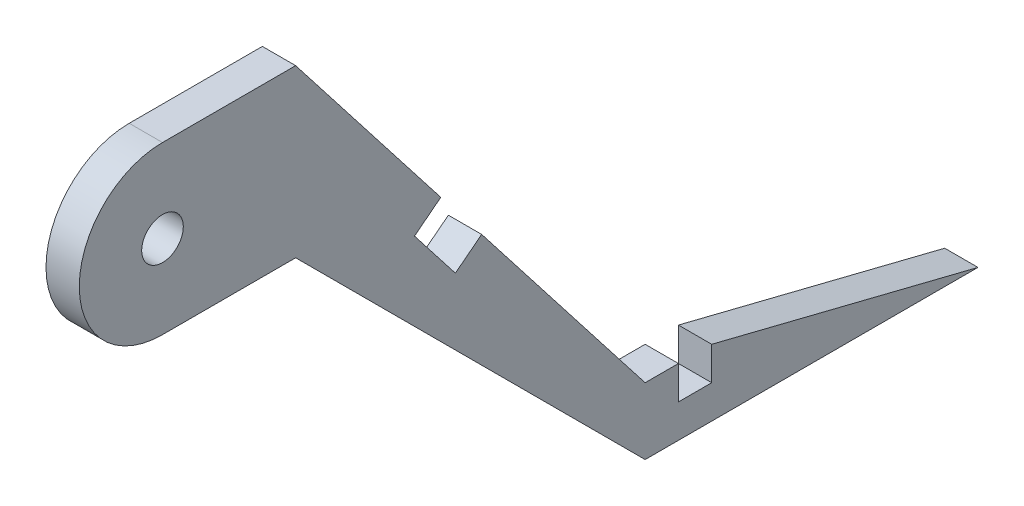
from build123d import *

# Parameters (mm, degrees)
MAIN_DEPTH    = 12.7
SKETCH2_R     = 7.9375
AXLE_DEPTH    = 12.7
SKETCH5_W     = 12.7
SKETCH5_H     = 25.4
BARWIDE_DEPTH = 12.7


with BuildPart() as part:
    # Sketch1 → main (new body)
    with BuildSketch(Plane(origin=(0, 0, 0), x_dir=(0, 0, -1), z_dir=(1, 0, 0))):
        with BuildLine():
            Line((0, 31.75), (50.8, 31.75))
            Line((50.8, 31.75), (184.15, -139.7))
            Line((184.15, -139.7), (196.85, -139.7))
            Line((196.85, -139.7), (196.85, -152.4))
            Line((196.85, -152.4), (209.55, -152.4))
            Line((209.55, -152.4), (209.55, -139.7))
            Line((209.55, -139.7), (311.15, -165.1))
            Line((311.15, -165.1), (184.15, -165.1))
            Line((184.15, -165.1), (50.8, -31.75))
            Line((50.8, -31.75), (0, -31.75))
            ThreePointArc((0, -31.75), (-31.75, 0), (0, 31.75))
        make_face()
    extrude(amount=MAIN_DEPTH)

    # Sketch2 → axle (cut)
    with BuildSketch(Plane(origin=(12.7, 0, 0), x_dir=(0, 0, -1), z_dir=(1, 0, 0))):
        Circle(SKETCH2_R)
    extrude(amount=-AXLE_DEPTH, mode=Mode.SUBTRACT)

    # Sketch5 → barwide (cut)
    with BuildSketch(Plane(origin=(0, 36.585769231, -47.038846154), x_dir=(-1, 0, 0), z_dir=(0, 0.6139406135149222, -0.789352217376325))):
        with Locations((-6.35, -109.029668746)):
            Rectangle(SKETCH5_W, SKETCH5_H)
    extrude(amount=-BARWIDE_DEPTH, mode=Mode.SUBTRACT)


solid = part.part
